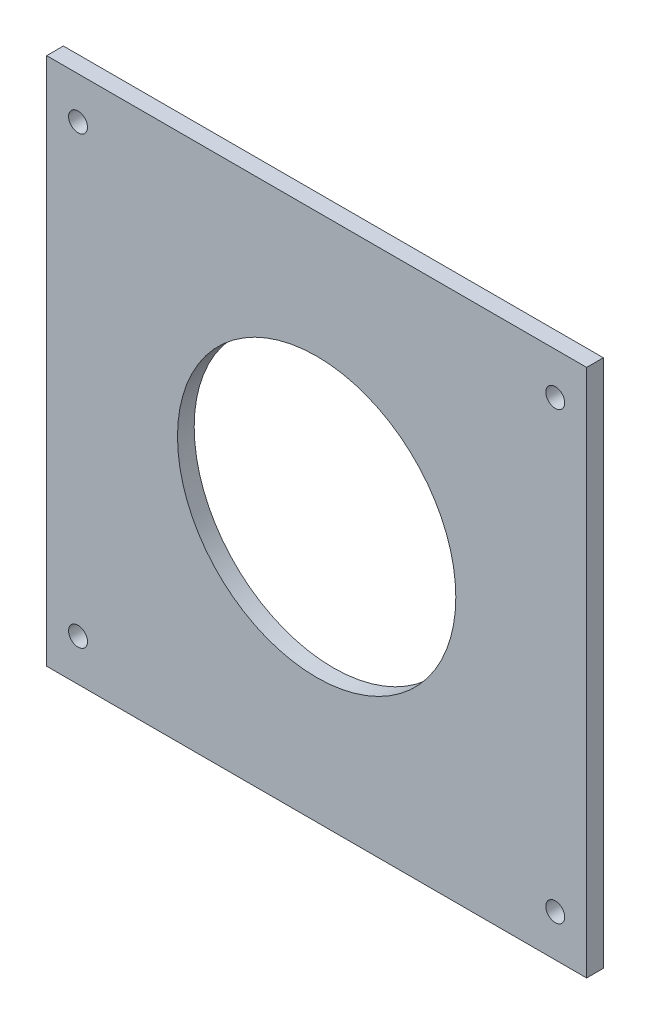
from build123d import *

# Parameters (mm, degrees)
BODY_SKETCH_W    = 97
BODY_SKETCH_H    = 95
BODY_DEPTH       = 3
HOLES_DEPTH      = 136.805007271
HOLES_DEPTH_BACK = 136.805007271
HOLES_SKETCH_R   = 1.7
HOLES_SKETCH_R_2 = 25


with BuildPart() as part:
    # Body sketch → Body (new body)
    with BuildSketch(Plane.XY):
        with Locations((48.5, 47.5)):
            Rectangle(BODY_SKETCH_W, BODY_SKETCH_H)
    extrude(amount=BODY_DEPTH)

    # Holes sketch → Holes (cut, two sides: drawn at the far end of the back side and taken through both)
    with BuildSketch(Plane.XY.offset(-HOLES_DEPTH_BACK)):
        with Locations((5.635, 7.495)):
            Circle(HOLES_SKETCH_R)
        with Locations((91.365, 7.495)):
            Circle(HOLES_SKETCH_R)
        with Locations((5.635, 87.505)):
            Circle(HOLES_SKETCH_R)
        with Locations((91.365, 87.505)):
            Circle(HOLES_SKETCH_R)
        with Locations((48.5, 47.5)):
            Circle(HOLES_SKETCH_R_2)
    extrude(amount=HOLES_DEPTH + HOLES_DEPTH_BACK, mode=Mode.SUBTRACT)


solid = part.part
